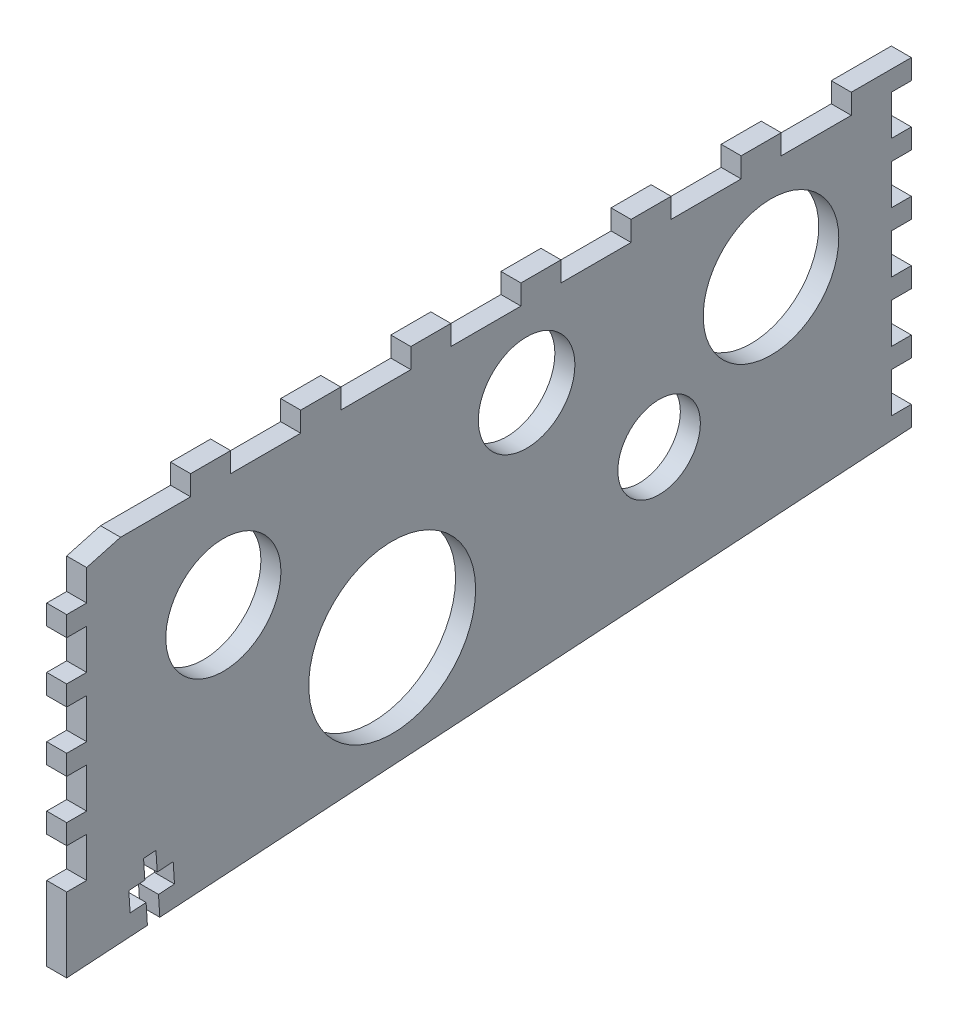
from build123d import *

# Parameters (mm, degrees)
ESQUISSE1_W                = 210.950231097
ESQUISSE1_H                = 93.600386247
BOSS_EXTRU_1_DEPTH         = 5
ENL_V_MAT_EXTRU_1_DEPTH    = 5
ESQUISSE4_W                = 5
ESQUISSE4_H                = 10
ENL_V_MAT_EXTRU_2_DEPTH    = 5
R_P_TITION_LIN_AIRE1_COUNT = 5
R_P_TITION_LIN_AIRE1_PITCH = 15
ESQUISSE5_W                = 17.5
ESQUISSE5_H                = 5
ENL_V_MAT_EXTRU_3_DEPTH    = 5
R_P_TITION_LIN_AIRE2_COUNT = 7
R_P_TITION_LIN_AIRE2_PITCH = 27.5
ENL_V_MAT_EXTRU_4_DEPTH    = 5
ESQUISSE8_R                = 10.303452194
ESQUISSE8_R_2              = 16.92457318
ESQUISSE8_R_3              = 12.058004818
ESQUISSE8_R_4              = 20.840400714
ESQUISSE8_R_5              = 14.375020811
ENL_V_MAT_EXTRU_5_DEPTH    = 5
SYM_TRIE1_COPY_1_SKETCH_W  = 5
SYM_TRIE1_COPY_1_SKETCH_H  = 10
SYM_TRIE1_COPY_1_DEPTH     = 5
SYM_TRIE1_COPY_2_SKETCH_W  = 5
SYM_TRIE1_COPY_2_SKETCH_H  = 10
SYM_TRIE1_COPY_2_DEPTH     = 5
SYM_TRIE1_COPY_3_SKETCH_W  = 5
SYM_TRIE1_COPY_3_SKETCH_H  = 10
SYM_TRIE1_COPY_3_DEPTH     = 5
SYM_TRIE1_COPY_4_SKETCH_W  = 5
SYM_TRIE1_COPY_4_SKETCH_H  = 10
SYM_TRIE1_COPY_4_DEPTH     = 5
SYM_TRIE1_COPY_5_SKETCH_W  = 5
SYM_TRIE1_COPY_5_SKETCH_H  = 10
SYM_TRIE1_COPY_5_DEPTH     = 5
ESQUISSE9_W                = 5
ESQUISSE9_H                = 3.1
ENL_V_MAT_EXTRU_6_DEPTH    = 15
ENL_V_MAT_EXTRU_7_DEPTH    = 15


with BuildPart() as part:
    # Esquisse1 → Boss.-Extru.1 (new body)
    with BuildSketch(Plane(origin=(163.933470491, 0, 0), x_dir=(0, 0, -1), z_dir=(1, 0, 0))):
        with Locations((-399.975115549, 32.112736727)):
            Rectangle(ESQUISSE1_W, ESQUISSE1_H)
    extrude(amount=-BOSS_EXTRU_1_DEPTH)

    # Esquisse3 → Enlèv. mat.-Extru.1 (cut)
    with BuildSketch(Plane(origin=(163.933470491, 0, 0), x_dir=(0, 0, -1), z_dir=(1, 0, 0))):
        Polygon((-505.450231097, -14.687456397), (-294.5, -1.08707015), (-294.5, -1.14043518), (-294.5, -14.687456397), align=None)
    extrude(amount=-ENL_V_MAT_EXTRU_1_DEPTH, mode=Mode.SUBTRACT)

    # Esquisse4 → Enlèv. mat.-Extru.2 (cut)
    with BuildSketch(Plane(origin=(163.933470491, 0, 0), x_dir=(0, 0, -1), z_dir=(1, 0, 0))):
        with Locations((-297, 8.91292985)):
            Rectangle(ESQUISSE4_W, ESQUISSE4_H)
    enl_v_mat_extru_2 = extrude(amount=-ENL_V_MAT_EXTRU_2_DEPTH, mode=Mode.SUBTRACT)

    # Répétition linéaire1: Enlèv. mat.-Extru.2 ×5
    with Locations(*[(0, i * R_P_TITION_LIN_AIRE1_PITCH, 0) for i in range(1, R_P_TITION_LIN_AIRE1_COUNT)]):
        add(enl_v_mat_extru_2, mode=Mode.SUBTRACT)

    # Esquisse5 → Enlèv. mat.-Extru.3 (cut)
    with BuildSketch(Plane(origin=(163.933470491, 0, 0), x_dir=(0, 0, -1), z_dir=(1, 0, 0))):
        with Locations((-318.25, 76.41292985)):
            Rectangle(ESQUISSE5_W, ESQUISSE5_H)
    enl_v_mat_extru_3 = extrude(amount=-ENL_V_MAT_EXTRU_3_DEPTH, mode=Mode.SUBTRACT)

    # Répétition linéaire2: Enlèv. mat.-Extru.3 ×7
    with Locations(*[(0, 0, i * R_P_TITION_LIN_AIRE2_PITCH) for i in range(1, R_P_TITION_LIN_AIRE2_COUNT)]):
        add(enl_v_mat_extru_3, mode=Mode.SUBTRACT)

    # Esquisse6 → Enlèv. mat.-Extru.4 (cut)
    with BuildSketch(Plane(origin=(163.933470491, 0, 0), x_dir=(0, 0, -1), z_dir=(1, 0, 0))):
        Polygon((-492, 73.91292985), (-505.450231097, 70.214096677), (-505.450231097, 78.91292985), (-492, 78.91292985), align=None)
    extrude(amount=-ENL_V_MAT_EXTRU_4_DEPTH, mode=Mode.SUBTRACT)

    # Esquisse8 → Enlèv. mat.-Extru.5 (cut)
    with BuildSketch(Plane(origin=(163.933470491, 0, 0), x_dir=(0, 0, -1), z_dir=(1, 0, 0))):
        with Locations((-357.495437595, 26.166642192)):
            Circle(ESQUISSE8_R)
        with Locations((-329.552133235, 48.980591934)):
            Circle(ESQUISSE8_R_2)
        with Locations((-390.585162306, 54.491117128)):
            Circle(ESQUISSE8_R_3)
        with Locations((-424.160939117, 18.322009653)):
            Circle(ESQUISSE8_R_4)
        with Locations((-466.318690215, 46.435552099)):
            Circle(ESQUISSE8_R_5)
    extrude(amount=-ENL_V_MAT_EXTRU_5_DEPTH, mode=Mode.SUBTRACT)

    # Symétrie1 copy 1 sketch → Symétrie1 copy 1 (cut)
    with BuildSketch(Plane(origin=(163.933470491, 15, 799.950231097), x_dir=(0, 0, 1), z_dir=(1, 0, 0))):
        with Locations((-297, -8.91292985)):
            Rectangle(SYM_TRIE1_COPY_1_SKETCH_W, SYM_TRIE1_COPY_1_SKETCH_H)
    extrude(amount=-SYM_TRIE1_COPY_1_DEPTH, mode=Mode.SUBTRACT)

    # Symétrie1 copy 2 sketch → Symétrie1 copy 2 (cut)
    with BuildSketch(Plane(origin=(163.933470491, 30, 799.950231097), x_dir=(0, 0, 1), z_dir=(1, 0, 0))):
        with Locations((-297, -8.91292985)):
            Rectangle(SYM_TRIE1_COPY_2_SKETCH_W, SYM_TRIE1_COPY_2_SKETCH_H)
    extrude(amount=-SYM_TRIE1_COPY_2_DEPTH, mode=Mode.SUBTRACT)

    # Symétrie1 copy 3 sketch → Symétrie1 copy 3 (cut)
    with BuildSketch(Plane(origin=(163.933470491, 45, 799.950231097), x_dir=(0, 0, 1), z_dir=(1, 0, 0))):
        with Locations((-297, -8.91292985)):
            Rectangle(SYM_TRIE1_COPY_3_SKETCH_W, SYM_TRIE1_COPY_3_SKETCH_H)
    extrude(amount=-SYM_TRIE1_COPY_3_DEPTH, mode=Mode.SUBTRACT)

    # Symétrie1 copy 4 sketch → Symétrie1 copy 4 (cut)
    with BuildSketch(Plane(origin=(163.933470491, 60, 799.950231097), x_dir=(0, 0, 1), z_dir=(1, 0, 0))):
        with Locations((-297, -8.91292985)):
            Rectangle(SYM_TRIE1_COPY_4_SKETCH_W, SYM_TRIE1_COPY_4_SKETCH_H)
    extrude(amount=-SYM_TRIE1_COPY_4_DEPTH, mode=Mode.SUBTRACT)

    # Symétrie1 copy 5 sketch → Symétrie1 copy 5 (cut)
    with BuildSketch(Plane(origin=(163.933470491, 0, 799.950231097), x_dir=(0, 0, 1), z_dir=(1, 0, 0))):
        with Locations((-297, -8.91292985)):
            Rectangle(SYM_TRIE1_COPY_5_SKETCH_W, SYM_TRIE1_COPY_5_SKETCH_H)
    extrude(amount=-SYM_TRIE1_COPY_5_DEPTH, mode=Mode.SUBTRACT)

    # Esquisse9 → Enlèv. mat.-Extru.6 (cut)
    with BuildSketch(Plane(origin=(0, 17.825842347, 1.149267957), x_dir=(1, 0, 0), z_dir=(0, -0.9979281364682809, -0.06433843676173626))):
        with Locations((161.433470491, 483.588677553)):
            Rectangle(ESQUISSE9_W, ESQUISSE9_H)
    extrude(amount=-ENL_V_MAT_EXTRU_6_DEPTH, mode=Mode.SUBTRACT)

    # Esquisse10 → Enlèv. mat.-Extru.7 (cut)
    with BuildSketch(Plane(origin=(163.933470491, 0, 0), x_dir=(0, 0, -1), z_dir=(1, 0, 0))):
        Polygon((-485.612619151, -8.271594794), (-489.604331697, -8.528948541), (-489.926023881, -3.539307858), (-485.934311335, -3.281954111), align=None)
    enl_v_mat_extru_7 = extrude(amount=-ENL_V_MAT_EXTRU_7_DEPTH, mode=Mode.SUBTRACT)

    # Symétrie2: Enlèv. mat.-Extru.7 across plane
    add(enl_v_mat_extru_7.mirror(Plane(origin=(0, -31.113339549, 482.586747808), x_dir=(1, 0, 0), z_dir=(0, 0.06433843676173628, -0.997928136468281))), mode=Mode.SUBTRACT)


solid = part.part
